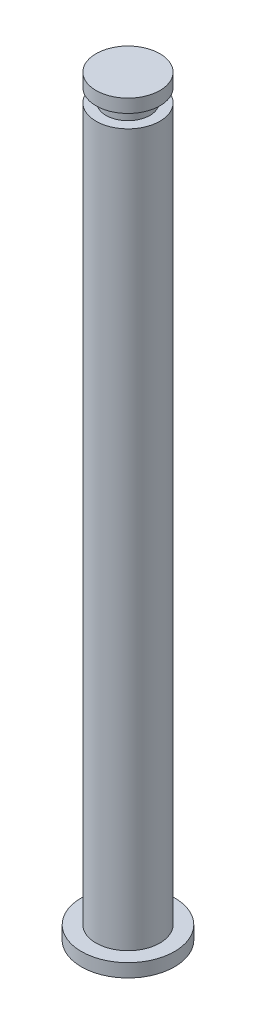
from build123d import *

# Parameters (mm, degrees)
CROQUIS1_R              = 3.5
CROQUIS1_R_2            = 2.4
SALIENTE_EXTRUIR1_DEPTH = 1
CROQUIS1_2_R            = 2.4
SALIENTE_EXTRUIR2_DEPTH = 56.5
CORTAR_EXTRUIR1_START   = -2
CROQUIS2_R              = 2.4
CROQUIS2_R_2            = 1.65
CORTAR_EXTRUIR1_DEPTH   = 1


with BuildPart() as part:
    # Croquis1 → Saliente-Extruir1 (new body)
    with BuildSketch(Plane(origin=(0, 0, 0), x_dir=(1, 0, 0), z_dir=(0, 1, 0))):
        Circle(CROQUIS1_R)
        Circle(CROQUIS1_R_2, mode=Mode.SUBTRACT)
    extrude(amount=SALIENTE_EXTRUIR1_DEPTH)

    # Croquis1<2> → Saliente-Extruir2 (add)
    with BuildSketch(Plane(origin=(0, 0, 0), x_dir=(1, 0, 0), z_dir=(0, 1, 0))):
        Circle(CROQUIS1_2_R)
    extrude(amount=SALIENTE_EXTRUIR2_DEPTH)

    # Croquis2 → Cortar-Extruir1 (cut)
    with BuildSketch(Plane(origin=(0, 56.5, 0), x_dir=(1, 0, 0), z_dir=(0, 1, 0)).offset(CORTAR_EXTRUIR1_START)):
        Circle(CROQUIS2_R)
        Circle(CROQUIS2_R_2, mode=Mode.SUBTRACT)
    extrude(amount=CORTAR_EXTRUIR1_DEPTH, mode=Mode.SUBTRACT)


solid = part.part
